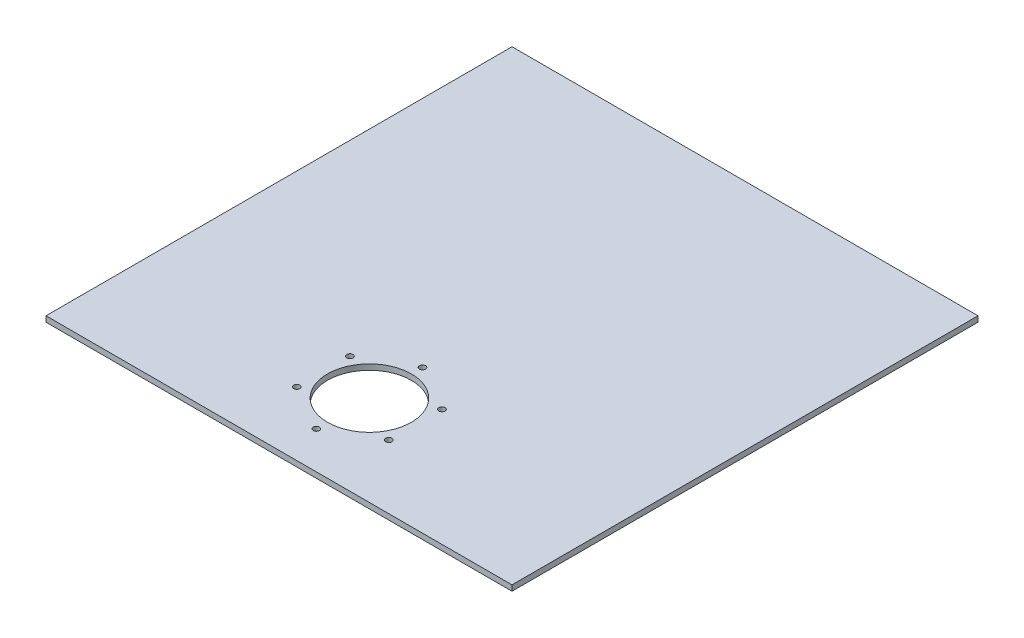
from build123d import *

# Parameters (mm, degrees)
SKETCH_1_W               = 250
SKETCH_1_H               = 250
EXTRUDE_1_DEPTH          = 3
HOLE_WIZARD_1_D          = 3.3
PATTERN_CIRCULAR_1_COUNT = 6
SKETCH_5_R               = 22.5
CUT_EXTRUDE_1_DEPTH      = 10


with BuildPart() as part:
    # 草图1 → 凸台-拉伸1 (new body)
    with BuildSketch(Plane(origin=(0, 0, 0), x_dir=(1, 0, 0), z_dir=(0, 1, 0))):
        Rectangle(SKETCH_1_W, SKETCH_1_H)
    extrude(amount=EXTRUDE_1_DEPTH)

    # 孔1 (through all)
    with Locations(Plane(origin=(0, 3, 0), x_dir=(1, 0, 0), z_dir=(0, 1, 0))):
        with Locations((0, -48)):
            hole_wizard_1 = Hole(HOLE_WIZARD_1_D / 2)

    # 阵列(圆周)1: 孔1 ×6 about axis
    pattern_circular_1_axis = Axis((0, 0, 76.5), (0, 1, 0))
    for i in range(1, PATTERN_CIRCULAR_1_COUNT):
        add(hole_wizard_1.rotate(pattern_circular_1_axis, i * 360 / PATTERN_CIRCULAR_1_COUNT), mode=Mode.SUBTRACT)

    # 草图5 → 切除-拉伸1 (cut)
    with BuildSketch(Plane(origin=(0, 3, 0), x_dir=(1, 0, 0), z_dir=(0, 1, 0))):
        with Locations(Location((0, -76.5, 0), (0, 0, 270))):
            Circle(SKETCH_5_R)
    extrude(amount=-CUT_EXTRUDE_1_DEPTH, mode=Mode.SUBTRACT)


solid = part.part
